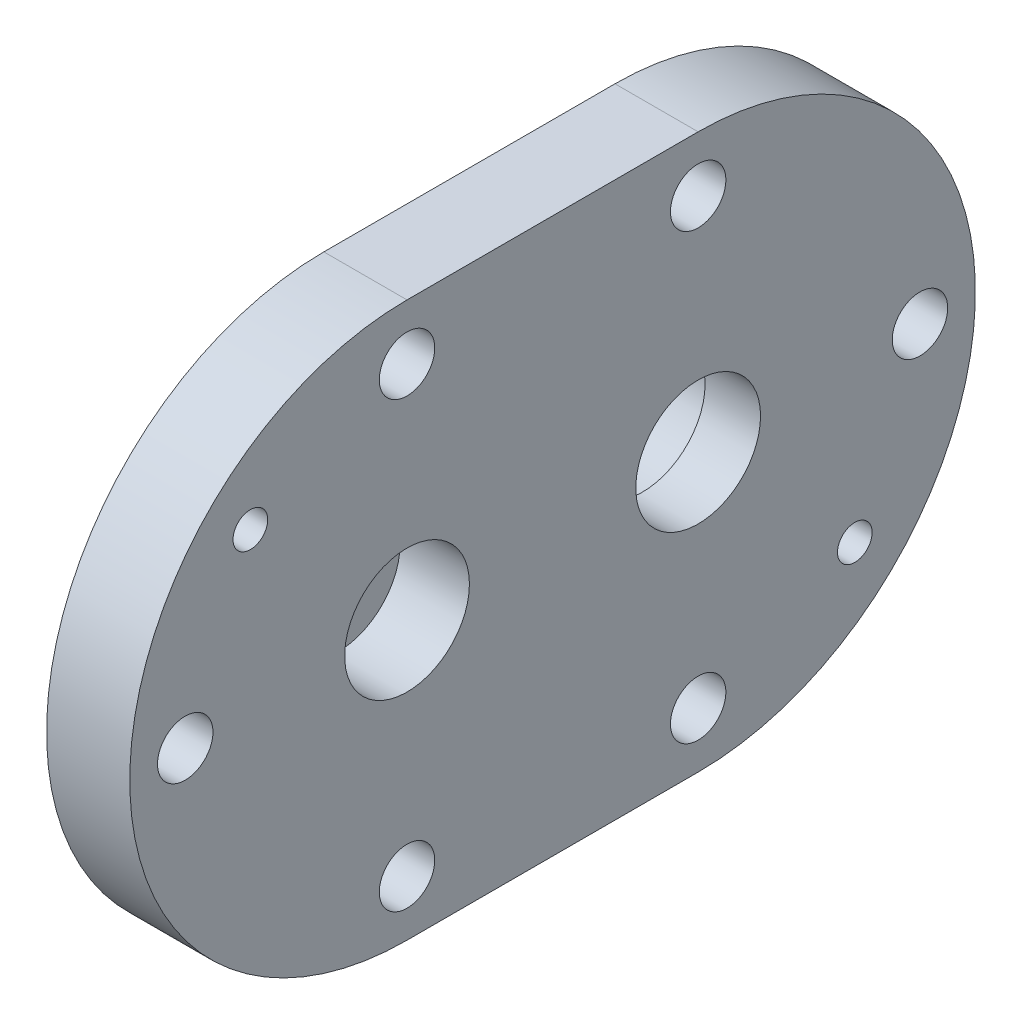
from build123d import *

# Parameters (mm, degrees)
F_01_FLANGE_DEPTH    = 12
SKETCH_2_R           = 16
F_02_BOSS_UP_DEPTH   = 10
SKETCH_3_R           = 16
F_03_BOSS_LO_DEPTH   = 22
SKETCH_4_R           = 9
F_04_BORE_UP_DEPTH   = 10
SKETCH_5_R           = 9
F_05_BORE_LO_DEPTH   = 10
SKETCH_6_R           = 10
F_06_RV_CAVITY_DEPTH = 26
SKETCH_8_R           = 4
F_08_BOLT_0_DEPTH    = 14
SKETCH_9_R           = 4
F_08_BOLT_1_DEPTH    = 14
SKETCH_10_R          = 4
F_08_BOLT_2_DEPTH    = 14
SKETCH_11_R          = 4
F_08_BOLT_3_DEPTH    = 14
SKETCH_12_R          = 4
F_08_BOLT_4_DEPTH    = 14
SKETCH_13_R          = 4
F_08_BOLT_5_DEPTH    = 14
SKETCH_14_R          = 2.5
F_09_DOWEL_0_DEPTH   = 14
SKETCH_15_R          = 2.5
F_09_DOWEL_1_DEPTH   = 14


with BuildPart() as part:
    # 草图1 → 01_FLANGE (new body)
    with BuildSketch(Plane(origin=(-42, 0, 0), x_dir=(0, 0, -1), z_dir=(1, 0, 0))):
        with BuildLine():
            Line((-104, -40), (-62, -40))
            ThreePointArc((-62, -40), (-22, 0), (-62, 40))
            Line((-62, 40), (-104, 40))
            ThreePointArc((-104, 40), (-144, 0), (-104, -40))
        make_face()
    extrude(amount=F_01_FLANGE_DEPTH)

    # 草图2 → 02_BOSS_UP (add)
    with BuildSketch(Plane(origin=(-52, 0, 0), x_dir=(0, 0, -1), z_dir=(1, 0, 0))):
        with Locations((-104, 0)):
            Circle(SKETCH_2_R)
    extrude(amount=F_02_BOSS_UP_DEPTH)

    # 草图3 → 03_BOSS_LO (add)
    with BuildSketch(Plane(origin=(-64, 0, 0), x_dir=(0, 0, -1), z_dir=(1, 0, 0))):
        with Locations((-62, 0)):
            Circle(SKETCH_3_R)
    extrude(amount=F_03_BOSS_LO_DEPTH)

    # 草图4 → 04_BORE_UP (cut)
    with BuildSketch(Plane(origin=(-30, 0, 0), x_dir=(0, 0, -1), z_dir=(1, 0, 0))):
        with Locations((-104, 0)):
            Circle(SKETCH_4_R)
    extrude(amount=-F_04_BORE_UP_DEPTH, mode=Mode.SUBTRACT)

    # 草图5 → 05_BORE_LO (cut)
    with BuildSketch(Plane(origin=(-30, 0, 0), x_dir=(0, 0, -1), z_dir=(1, 0, 0))):
        with Locations((-62, 0)):
            Circle(SKETCH_5_R)
    extrude(amount=-F_05_BORE_LO_DEPTH, mode=Mode.SUBTRACT)

    # 草图6 → 06_RV_CAVITY (cut)
    with BuildSketch(Plane(origin=(-64, 0, 0), x_dir=(0, 0, -1), z_dir=(1, 0, 0))):
        with Locations(Location((-62, 0, 0), (0, 0, 180))):
            Circle(SKETCH_6_R)
    extrude(amount=F_06_RV_CAVITY_DEPTH, mode=Mode.SUBTRACT)

    # 草图8 → 08_BOLT_0 (cut)
    with BuildSketch(Plane(origin=(-43, 0, 0), x_dir=(0, 0, -1), z_dir=(1, 0, 0))):
        with Locations((-104, 32)):
            Circle(SKETCH_8_R)
    extrude(amount=F_08_BOLT_0_DEPTH, mode=Mode.SUBTRACT)

    # 草图9 → 08_BOLT_1 (cut)
    with BuildSketch(Plane(origin=(-43, 0, 0), x_dir=(0, 0, -1), z_dir=(1, 0, 0))):
        with Locations((-104, -32)):
            Circle(SKETCH_9_R)
    extrude(amount=F_08_BOLT_1_DEPTH, mode=Mode.SUBTRACT)

    # 草图10 → 08_BOLT_2 (cut)
    with BuildSketch(Plane(origin=(-43, 0, 0), x_dir=(0, 0, -1), z_dir=(1, 0, 0))):
        with Locations((-62, 32)):
            Circle(SKETCH_10_R)
    extrude(amount=F_08_BOLT_2_DEPTH, mode=Mode.SUBTRACT)

    # 草图11 → 08_BOLT_3 (cut)
    with BuildSketch(Plane(origin=(-43, 0, 0), x_dir=(0, 0, -1), z_dir=(1, 0, 0))):
        with Locations((-62, -32)):
            Circle(SKETCH_11_R)
    extrude(amount=F_08_BOLT_3_DEPTH, mode=Mode.SUBTRACT)

    # 草图12 → 08_BOLT_4 (cut)
    with BuildSketch(Plane(origin=(-43, 0, 0), x_dir=(0, 0, -1), z_dir=(1, 0, 0))):
        with Locations((-136, 0)):
            Circle(SKETCH_12_R)
    extrude(amount=F_08_BOLT_4_DEPTH, mode=Mode.SUBTRACT)

    # 草图13 → 08_BOLT_5 (cut)
    with BuildSketch(Plane(origin=(-43, 0, 0), x_dir=(0, 0, -1), z_dir=(1, 0, 0))):
        with Locations((-30, 0)):
            Circle(SKETCH_13_R)
    extrude(amount=F_08_BOLT_5_DEPTH, mode=Mode.SUBTRACT)

    # 草图14 → 09_DOWEL_0 (cut)
    with BuildSketch(Plane(origin=(-43, 0, 0), x_dir=(0, 0, -1), z_dir=(1, 0, 0))):
        with Locations((-126.6, 22.6)):
            Circle(SKETCH_14_R)
    extrude(amount=F_09_DOWEL_0_DEPTH, mode=Mode.SUBTRACT)

    # 草图15 → 09_DOWEL_1 (cut)
    with BuildSketch(Plane(origin=(-43, 0, 0), x_dir=(0, 0, -1), z_dir=(1, 0, 0))):
        with Locations((-39.4, -22.6)):
            Circle(SKETCH_15_R)
    extrude(amount=F_09_DOWEL_1_DEPTH, mode=Mode.SUBTRACT)


solid = part.part
